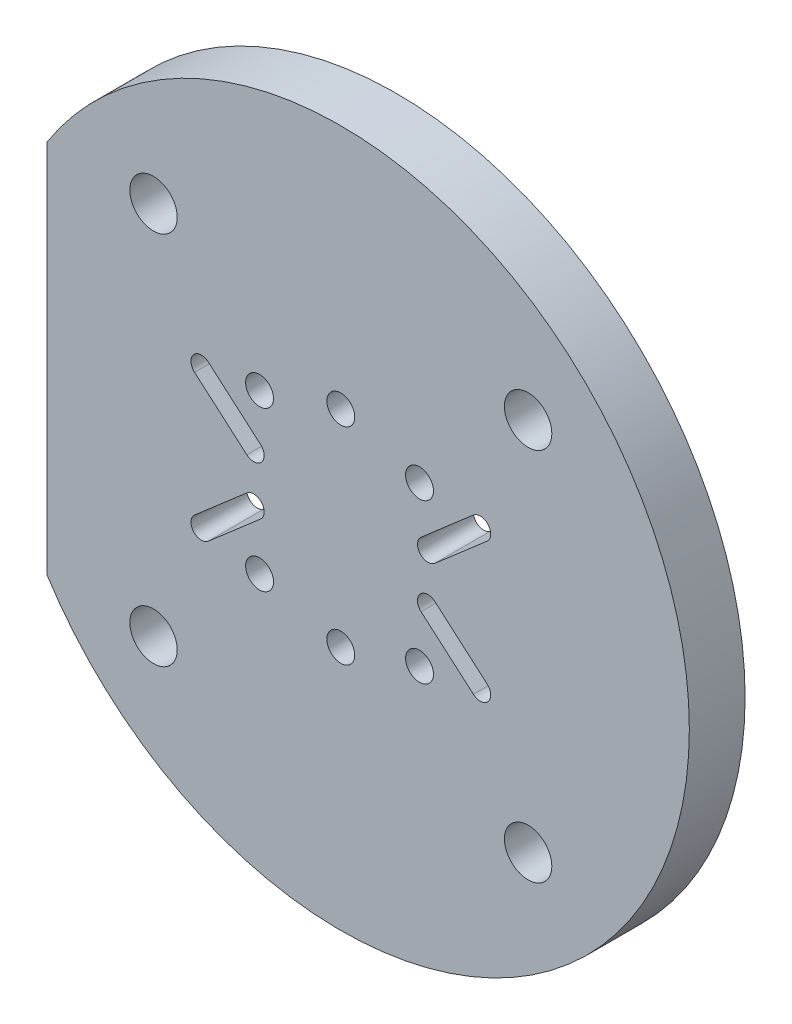
from build123d import *

# Parameters (mm, degrees)
ESQUISSE1_R             = 25
ESQUISSE1_R_2           = 1.7
BOSS_EXTRU_1_DEPTH      = 4
ESQUISSE11_R            = 1
ENL_V_MAT_EXTRU_1_DEPTH = 36.580893749
ESQUISSE13_W            = 4.903660669
ESQUISSE13_H            = 28.894120166
ENL_V_MAT_EXTRU_2_DEPTH = 36.580893749
ENL_V_MAT_EXTRU_3_DEPTH = 36.580893749


with BuildPart() as part:
    # Esquisse1 → Boss.-Extru.1 (new body)
    with BuildSketch(Plane.XY):
        Circle(ESQUISSE1_R)
        with Locations((-13.435028843, 13.435028843)):
            Circle(ESQUISSE1_R_2, mode=Mode.SUBTRACT)
        with Locations((13.435028843, 13.435028843)):
            Circle(ESQUISSE1_R_2, mode=Mode.SUBTRACT)
        with Locations((13.435028843, -13.435028843)):
            Circle(ESQUISSE1_R_2, mode=Mode.SUBTRACT)
        with Locations((-13.435028843, -13.435028843)):
            Circle(ESQUISSE1_R_2, mode=Mode.SUBTRACT)
    extrude(amount=BOSS_EXTRU_1_DEPTH)

    # Esquisse11 → Enlèv. mat.-Extru.1 (cut, through all)
    with BuildSketch(Plane(origin=(0, 0, 0), x_dir=(-1, 0, 0), z_dir=(0, 0, -1))):
        with Locations((0, 7.398882196)):
            Circle(ESQUISSE11_R)
        with Locations((5.827506735, 5.634287936)):
            Circle(ESQUISSE11_R)
        with Locations((5.827506735, -5.758693792)):
            Circle(ESQUISSE11_R)
        with Locations((0, -7.398882196)):
            Circle(ESQUISSE11_R)
        with Locations((-5.645080413, -5.758693792)):
            Circle(ESQUISSE11_R)
        with Locations((-5.645080413, 5.634287936)):
            Circle(ESQUISSE11_R)
    extrude(amount=-ENL_V_MAT_EXTRU_1_DEPTH, mode=Mode.SUBTRACT)

    # Esquisse13 → Enlèv. mat.-Extru.2 (cut, through all)
    with BuildSketch(Plane(origin=(0, 0, 0), x_dir=(-1, 0, 0), z_dir=(0, 0, -1))):
        with Locations((23.534998976, -1.01203124)):
            Rectangle(ESQUISSE13_W, ESQUISSE13_H)
    extrude(amount=-ENL_V_MAT_EXTRU_2_DEPTH, mode=Mode.SUBTRACT)

    # Esquisse10 → Enlèv. mat.-Extru.3 (cut, through all)
    with BuildSketch(Plane.XY.offset(4)):
        with BuildLine():
            Line((-5.758802096, -2.316766812), (-9.508802096, -5.566766812))
            ThreePointArc((-9.508802096, -5.566766812), (-10.566766812, -5.491197904), (-10.491197904, -4.433233188))
            Line((-10.491197904, -4.433233188), (-6.741197904, -1.183233188))
            ThreePointArc((-6.741197904, -1.183233188), (-5.683233188, -1.258802096), (-5.758802096, -2.316766812))
        make_face()
        with BuildLine():
            Line((-6.741197904, 1.183233188), (-10.491197904, 4.433233188))
            ThreePointArc((-10.491197904, 4.433233188), (-10.566766812, 5.491197904), (-9.508802096, 5.566766812))
            Line((-9.508802096, 5.566766812), (-5.758802096, 2.316766812))
            ThreePointArc((-5.758802096, 2.316766812), (-5.683233188, 1.258802096), (-6.741197904, 1.183233188))
        make_face()
        with BuildLine():
            Line((9.508802096, -5.566766812), (5.758802096, -2.316766812))
            ThreePointArc((5.758802096, -2.316766812), (5.683233188, -1.258802096), (6.741197904, -1.183233188))
            Line((6.741197904, -1.183233188), (10.491197904, -4.433233188))
            ThreePointArc((10.491197904, -4.433233188), (10.566766812, -5.491197904), (9.508802096, -5.566766812))
        make_face()
        with BuildLine():
            Line((10.491197904, 4.433233188), (6.741197904, 1.183233188))
            ThreePointArc((6.741197904, 1.183233188), (5.683233188, 1.258802096), (5.758802096, 2.316766812))
            Line((5.758802096, 2.316766812), (9.508802096, 5.566766812))
            ThreePointArc((9.508802096, 5.566766812), (10.566766812, 5.491197904), (10.491197904, 4.433233188))
        make_face()
    extrude(amount=-ENL_V_MAT_EXTRU_3_DEPTH, mode=Mode.SUBTRACT)


solid = part.part
